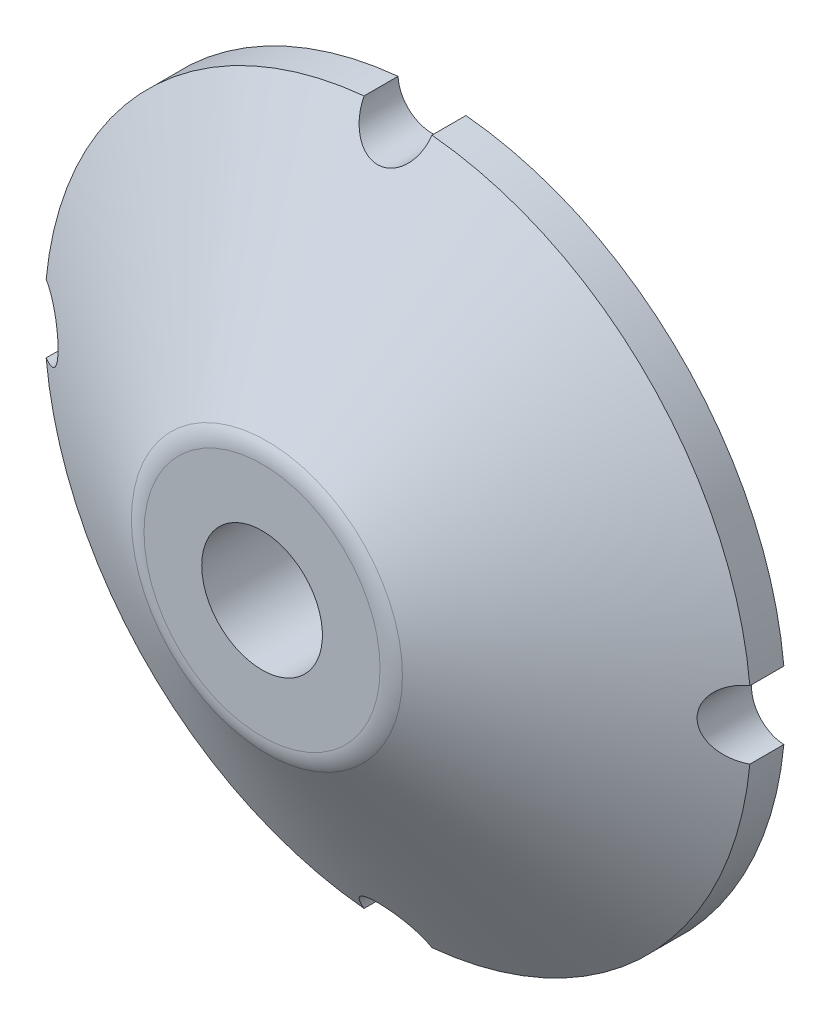
from build123d import *

# Parameters (mm, degrees)
CUT_EXTRUDE1_REACH = 33.069
SKETCH3_R          = 2
FILLET1_R          = 2


with BuildPart() as part:
    # Sketch2 → Revolve1 (revolve)
    with BuildSketch(Plane(origin=(0, 0, 0), x_dir=(0, 0, -1), z_dir=(1, 0, 0)), mode=Mode.PRIVATE) as revolve1_sk:
        Polygon((0, 17), (0, 20.8), (-2, 20.8), (-10, 7.5), (-10, 3.55), (0, 3.55), (0, 5.3), (-7.6, 5.3), (-7.6, 7.5), (-2, 17), align=None)
    revolve(revolve1_sk.sketch.rotate(Axis((0, 0, 0), (0, 0, 1)), 90), axis=Axis((0, 0, 0), (0, 0, 1)))

    # Cut-Extrude1: up to this cone (the profile starts inside it)
    cut_extrude1_end = Plane(origin=(0, 0, 0), z_dir=(0, 0, -1)).offset(-14.511277195) * Cone(1.663e-06, 120.041275, 72.205277195, align=(Align.CENTER, Align.CENTER, Align.MIN), mode=Mode.PRIVATE)
    # Sketch3 → Cut-Extrude1 (cut, up to the surface)
    with BuildSketch(Plane.XY, mode=Mode.PRIVATE) as cut_extrude1_sk1:
        with Locations((0, 20.8)):
            Circle(SKETCH3_R)
    cut_extrude1_tool1 = extrude(cut_extrude1_sk1.sketch, amount=CUT_EXTRUDE1_REACH, mode=Mode.PRIVATE) & cut_extrude1_end
    add(cut_extrude1_tool1.solids().sort_by_distance((0, 20.8, 0))[0], mode=Mode.SUBTRACT)
    # Sketch3 → Cut-Extrude1 (cut, up to the surface)
    with BuildSketch(Plane.XY, mode=Mode.PRIVATE) as cut_extrude1_sk2:
        with Locations((20.8, 0)):
            Circle(SKETCH3_R)
    cut_extrude1_tool2 = extrude(cut_extrude1_sk2.sketch, amount=CUT_EXTRUDE1_REACH, mode=Mode.PRIVATE) & cut_extrude1_end
    add(cut_extrude1_tool2.solids().sort_by_distance((20.8, 0, 0))[0], mode=Mode.SUBTRACT)
    # Sketch3 → Cut-Extrude1 (cut, up to the surface)
    with BuildSketch(Plane.XY, mode=Mode.PRIVATE) as cut_extrude1_sk3:
        with Locations((0, -20.8)):
            Circle(SKETCH3_R)
    cut_extrude1_tool3 = extrude(cut_extrude1_sk3.sketch, amount=CUT_EXTRUDE1_REACH, mode=Mode.PRIVATE) & cut_extrude1_end
    add(cut_extrude1_tool3.solids().sort_by_distance((0, -20.8, 0))[0], mode=Mode.SUBTRACT)
    # Sketch3 → Cut-Extrude1 (cut, up to the surface)
    with BuildSketch(Plane.XY, mode=Mode.PRIVATE) as cut_extrude1_sk4:
        with Locations((-20.8, 0)):
            Circle(SKETCH3_R)
    cut_extrude1_tool4 = extrude(cut_extrude1_sk4.sketch, amount=CUT_EXTRUDE1_REACH, mode=Mode.PRIVATE) & cut_extrude1_end
    add(cut_extrude1_tool4.solids().sort_by_distance((-20.8, 0, 0))[0], mode=Mode.SUBTRACT)

    # Fillet1
    fillet1_edges = [part.edges().sort_by_distance(p)[0] for p in [
        (7.5, 0, 10),
    ]]
    fillet(fillet1_edges, radius=FILLET1_R)


solid = part.part
